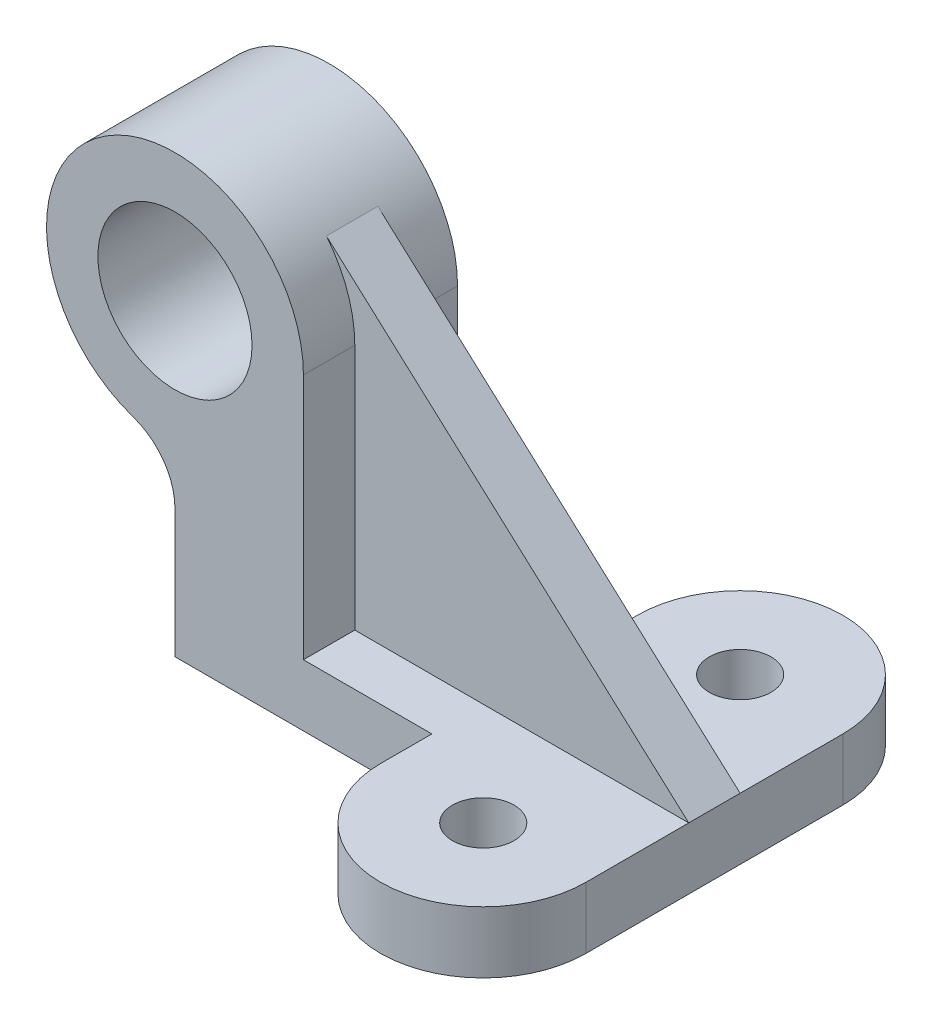
from build123d import *

# Parameters (mm, degrees)
SKETCH2_R           = 6
BOSS_EXTRUDE1_DEPTH = 12
SKETCH4_R           = 15
BOSS_EXTRUDE3_DEPTH = 30
RIB10_REACH         = 137.185
SKETCH8_WALL_W      = 367.382862114
SKETCH8_WALL_H      = 10


with BuildPart() as part:
    # Sketch2 → Boss-Extrude1 (new body)
    with BuildSketch(Plane(origin=(0, 0, 0), x_dir=(1, 0, 0), z_dir=(0, 1, 0))):
        with BuildLine():
            Line((20, -25), (20, 25))
            ThreePointArc((20, 25), (0, 45), (-20, 25))
            Line((-20, 25), (-20, 15))
            Line((-20, 15), (-70, 15))
            Line((-70, 15), (-70, -15))
            Line((-70, -15), (-20, -15))
            Line((-20, -15), (-20, -25))
            ThreePointArc((-20, -25), (0, -45), (20, -25))
        make_face()
        with Locations(Location((0, 25, 0), (0, 0, 270))):
            Circle(SKETCH2_R, mode=Mode.SUBTRACT)
        with Locations(Location((0, -25, 0), (0, 0, 90))):
            Circle(SKETCH2_R, mode=Mode.SUBTRACT)
    extrude(amount=BOSS_EXTRUDE1_DEPTH)

    # Sketch4 → Boss-Extrude3 (add)
    with BuildSketch(Plane.XY.offset(15)):
        with BuildLine():
            Line((-70, 25), (-70, 12))
            Line((-70, 12), (-45, 12))
            Line((-45, 12), (-45, 60))
            ThreePointArc((-45, 60), (-84.530954843, 80.34333678), (-78.108108108, 36.351351351))
            ThreePointArc((-78.108108108, 36.351351351), (-72.235198346, 31.974858325), (-70, 25))
        make_face()
        with Locations((-70, 60)):
            Circle(SKETCH4_R, mode=Mode.SUBTRACT)
    extrude(amount=-BOSS_EXTRUDE3_DEPTH)

    # Sketch8 wall → Rib10 (add, up to next)
    with BuildSketch(Plane(origin=(-15.260936943, 43.835856736, 0), x_dir=(-0.742235934483, 0.670138655476, 0), z_dir=(-0.670138655476, -0.742235934483, 0)), mode=Mode.PRIVATE) as rib10_sk1:
        Rectangle(SKETCH8_WALL_W, SKETCH8_WALL_H)
    rib10_tool1 = extrude(rib10_sk1.sketch, amount=RIB10_REACH, mode=Mode.PRIVATE) - part.part
    add(rib10_tool1.solids().sort_by_distance((-15.260936943, 43.835856736, 0))[0])


solid = part.part
